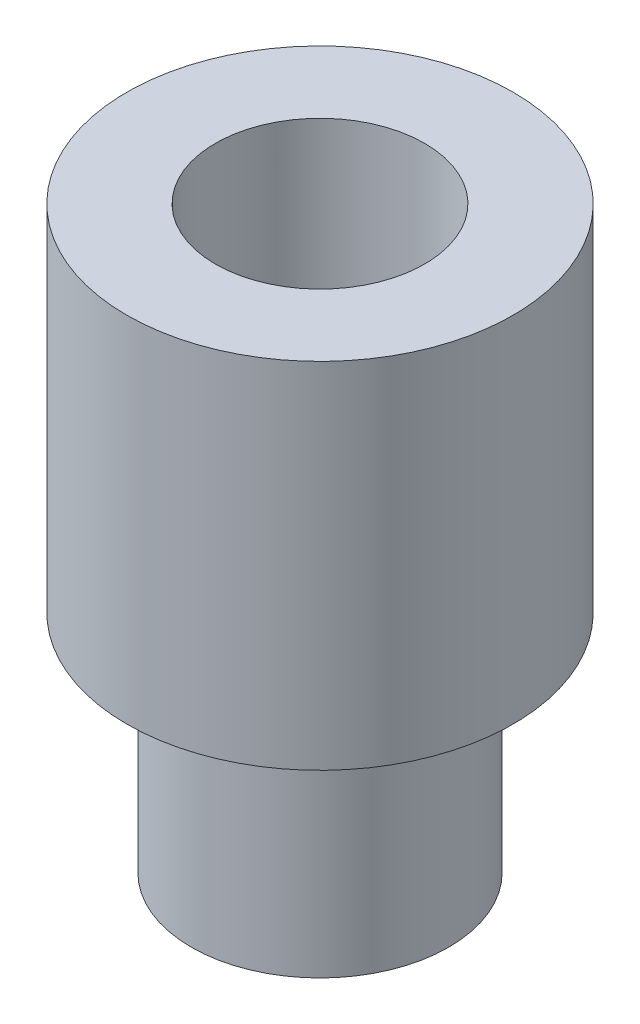
from build123d import *
from build123d.topology import SkipClean

# Parameters (mm, degrees)
CROQUIS2_R              = 6
CROQUIS2_R_2            = 3.25
SALIENTE_EXTRUIR1_DEPTH = 11
SALIENTE_EXTRUIR2_START = 7
CROQUIS3_R              = 4
CROQUIS3_R_2            = 3.25
SALIENTE_EXTRUIR2_DEPTH = 7


with BuildPart() as part:
    # Croquis2 → Saliente-Extruir1 (new body)
    with BuildSketch(Plane(origin=(0, 0, 0), x_dir=(1, 0, 0), z_dir=(0, 1, 0))):
        with Locations(Location((0, 0, 0), (0, 0, 270))):
            Circle(CROQUIS2_R)
        with Locations(Location((0, 0, 0), (0, 0, 270))):
            Circle(CROQUIS2_R_2, mode=Mode.SUBTRACT)
    extrude(amount=SALIENTE_EXTRUIR1_DEPTH)

    # Croquis3 → Saliente-Extruir2 (add)
    with SkipClean():  # the faces are left unmerged after this step: merging them gives an invalid solid
        with BuildSketch(Plane.XZ.offset(SALIENTE_EXTRUIR2_START)):
            with Locations(Location((0, 0, 0), (0, 0, 90))):
                Circle(CROQUIS3_R)
            with Locations(Location((0, 0, 0), (0, 0, 270))):
                Circle(CROQUIS3_R_2, mode=Mode.SUBTRACT)
        extrude(amount=-SALIENTE_EXTRUIR2_DEPTH)


solid = part.part
